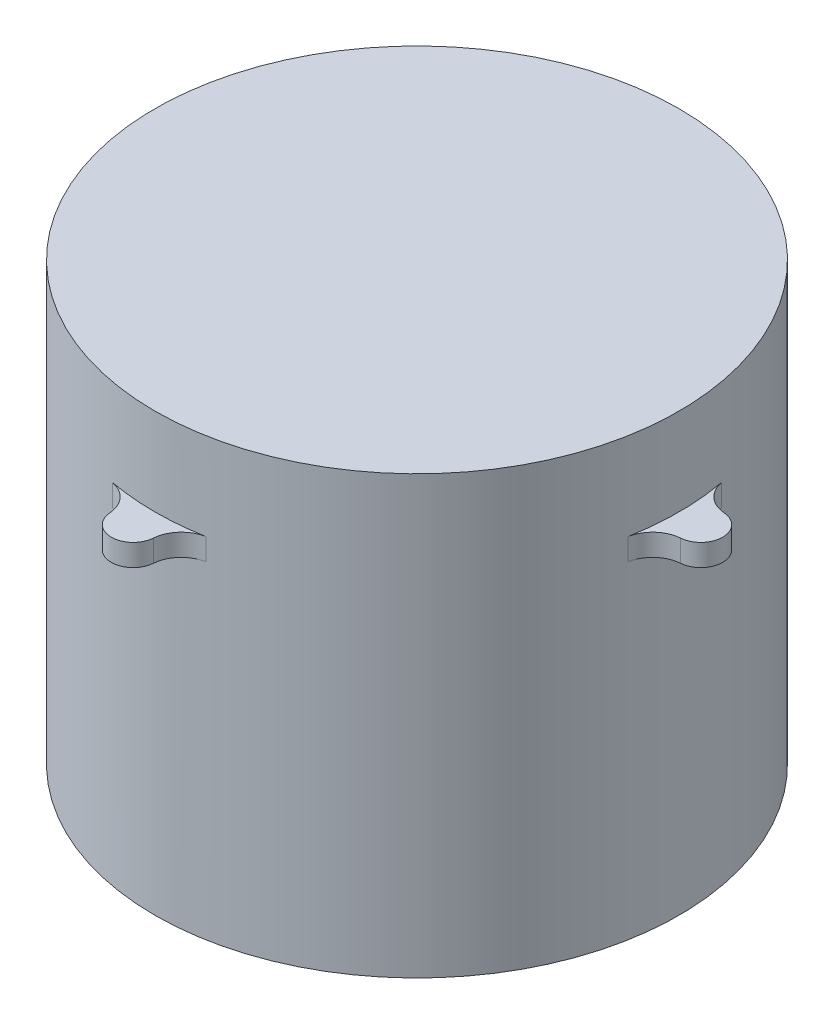
from build123d import *

# Parameters (mm, degrees)
SKETCH1_R           = 60
BOSS_EXTRUDE1_DEPTH = 100
BOSS_EXTRUDE2_START = -25
BOSS_EXTRUDE2_DEPTH = 5


with BuildPart() as part:
    # Sketch1 → Boss-Extrude1 (new body)
    with BuildSketch(Plane(origin=(0, 0, 0), x_dir=(1, 0, 0), z_dir=(0, 1, 0))):
        with Locations(Location((0, 0, 0), (0, 0, 270))):
            Circle(SKETCH1_R)
    extrude(amount=BOSS_EXTRUDE1_DEPTH)

    # Sketch2 → Boss-Extrude2 (add)
    with BuildSketch(Plane(origin=(0, 100, 0), x_dir=(1, 0, 0), z_dir=(0, 1, 0)).offset(BOSS_EXTRUDE2_START)):
        with BuildLine():
            ThreePointArc((-10.714427791, 59.035591274), (-42.426406871, 42.426406871), (-59.035591274, 10.714427791))
            ThreePointArc((-59.035591274, 10.714427791), (-61.233489712, 6.767544156), (-65.384615385, 4.985185153))
            ThreePointArc((-65.384615385, 4.985185153), (-70, 0), (-65.384615385, -4.985185153))
            ThreePointArc((-65.384615385, -4.985185153), (-61.233489712, -6.767544156), (-59.035591274, -10.714427791))
            ThreePointArc((-59.035591274, -10.714427791), (-42.426406871, -42.426406871), (-10.714427791, -59.035591274))
            ThreePointArc((-10.714427791, -59.035591274), (-6.767544156, -61.233489712), (-4.985185153, -65.384615385))
            ThreePointArc((-4.985185153, -65.384615385), (0, -70), (4.985185153, -65.384615385))
            ThreePointArc((4.985185153, -65.384615385), (6.767544156, -61.233489712), (10.714427791, -59.035591274))
            ThreePointArc((10.714427791, -59.035591274), (42.426406871, -42.426406871), (59.035591274, -10.714427791))
            ThreePointArc((59.035591274, -10.714427791), (61.233489712, -6.767544156), (65.384615385, -4.985185153))
            ThreePointArc((65.384615385, -4.985185153), (70, 0), (65.384615385, 4.985185153))
            ThreePointArc((65.384615385, 4.985185153), (61.233489712, 6.767544156), (59.035591274, 10.714427791))
            ThreePointArc((59.035591274, 10.714427791), (42.426406871, 42.426406871), (10.714427791, 59.035591274))
            ThreePointArc((10.714427791, 59.035591274), (6.767544156, 61.233489712), (4.985185153, 65.384615385))
            ThreePointArc((4.985185153, 65.384615385), (0, 70), (-4.985185153, 65.384615385))
            ThreePointArc((-4.985185153, 65.384615385), (-6.767544156, 61.233489712), (-10.714427791, 59.035591274))
        make_face()
    extrude(amount=BOSS_EXTRUDE2_DEPTH)


solid = part.part
